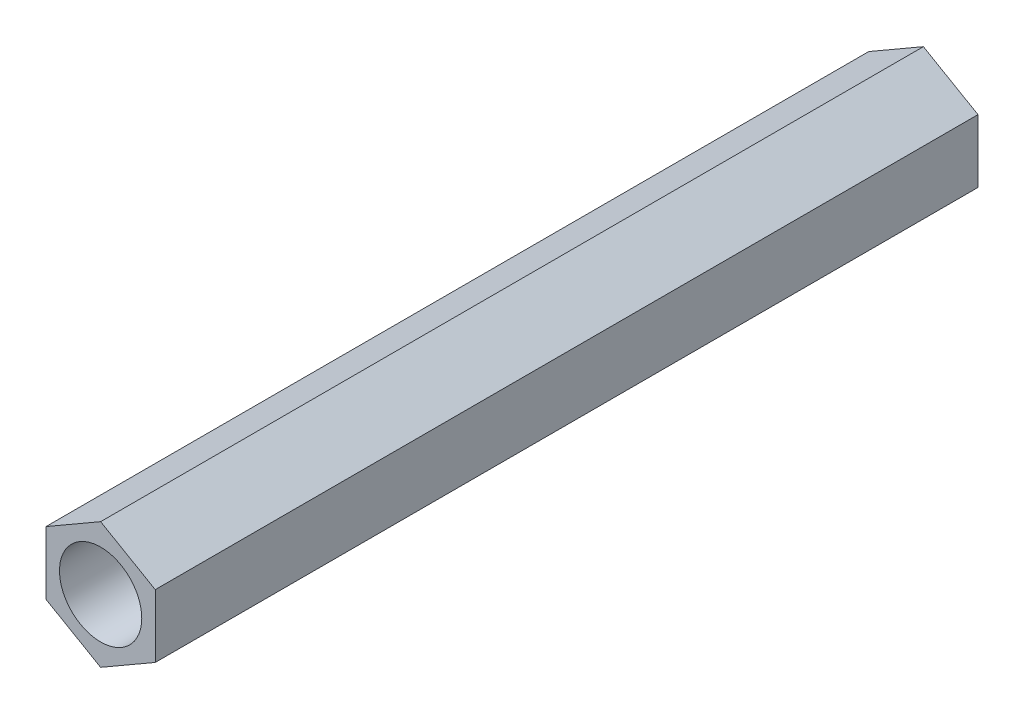
from build123d import *

# Parameters (mm, degrees)
SKETCH_1_R      = 1.5
EXTRUDE_1_DEPTH = 30


with BuildPart() as part:
    # 草图1 → 凸台-拉伸1 (new body)
    with BuildSketch(Plane.XY):
        Polygon((0, 2.3), (-1.991858429, 1.15), (-1.991858429, -1.15), (0, -2.3), (1.991858429, -1.15), (1.991858429, 1.15), align=None)
        Circle(SKETCH_1_R, mode=Mode.SUBTRACT)
    extrude(amount=EXTRUDE_1_DEPTH)


solid = part.part
